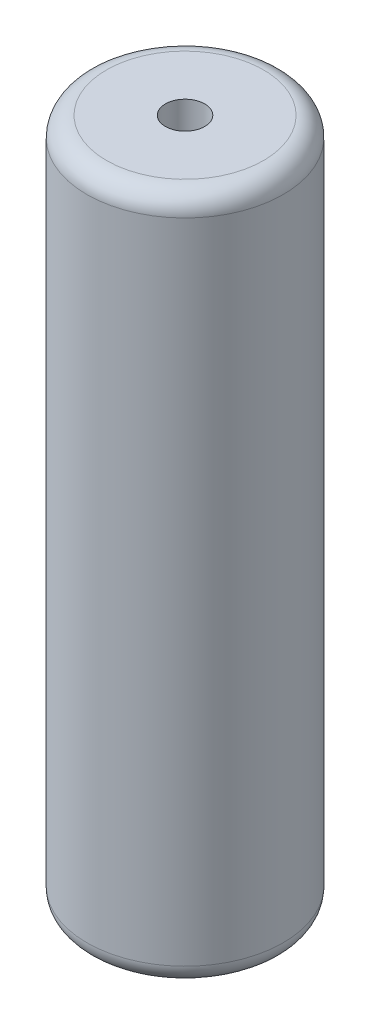
from build123d import *

# Parameters (mm, degrees)
SKETCH1_R           = 10
BOSS_EXTRUDE1_DEPTH = 70
SKETCH2_R           = 2
CUT_EXTRUDE1_DEPTH  = 60
FILLET1_R           = 2
CUT_EXTRUDE2_START  = -5
SKETCH4_R           = 2
CUT_EXTRUDE2_DEPTH  = 5


with BuildPart() as part:
    # Sketch1 → Boss-Extrude1 (new body)
    with BuildSketch(Plane(origin=(0, 0, 0), x_dir=(1, 0, 0), z_dir=(0, 1, 0))):
        with Locations(Location((0, 0, 0), (0, 0, 270))):
            Circle(SKETCH1_R)
    extrude(amount=BOSS_EXTRUDE1_DEPTH)

    # Sketch2 → Cut-Extrude1 (cut)
    with BuildSketch(Plane(origin=(0, 70, 0), x_dir=(1, 0, 0), z_dir=(0, 1, 0))):
        with Locations(Location((0, 0, 0), (0, 0, 270))):
            Circle(SKETCH2_R)
    extrude(amount=-CUT_EXTRUDE1_DEPTH, mode=Mode.SUBTRACT)

    # Fillet1
    fillet1_edges = [part.edges().sort_by_distance(p)[0] for p in [
        (0, 0, -10),
        (0, 70, -10),
    ]]
    fillet(fillet1_edges, radius=FILLET1_R)

    # Sketch4 → Cut-Extrude2 (cut)
    with BuildSketch(Plane.XZ.offset(CUT_EXTRUDE2_START)):
        with Locations(Location((0, 0, 0), (0, 0, 90))):
            Circle(SKETCH4_R)
    extrude(amount=CUT_EXTRUDE2_DEPTH, mode=Mode.SUBTRACT)


solid = part.part
